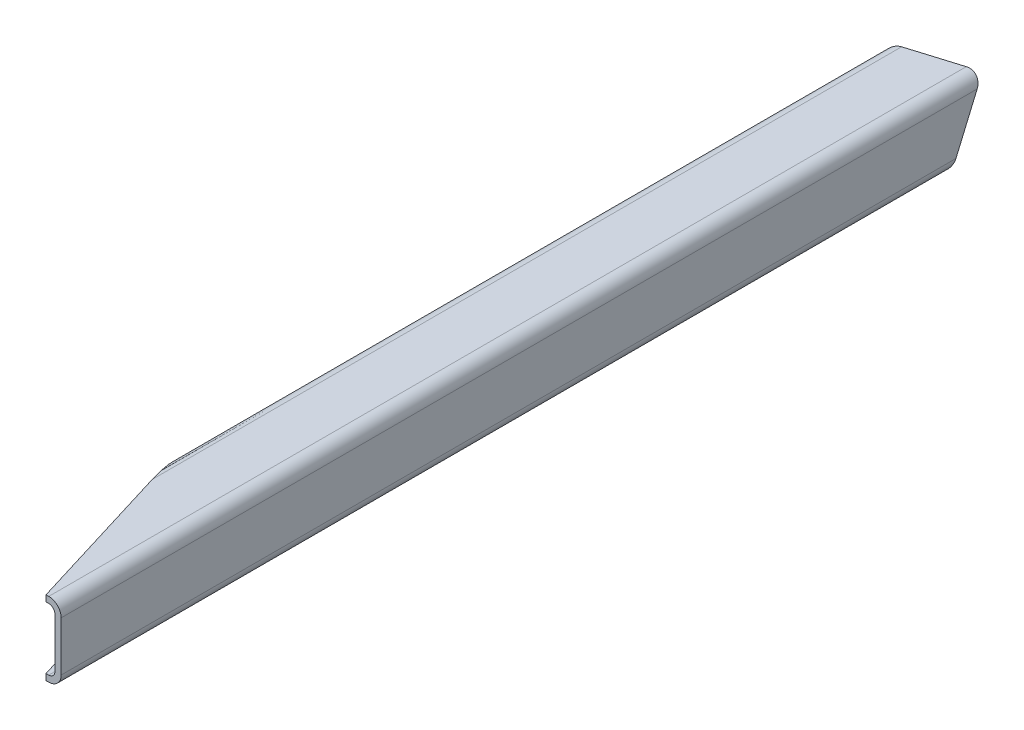
from build123d import *

# Parameters (mm, degrees)
BOSS_EXTRUDE1_DEPTH     = 584.2
CUT_EXTRUDE1_DEPTH      = 1168.4
CUT_EXTRUDE1_DEPTH_BACK = 587.679520693
CUT_EXTRUDE2_DEPTH      = 587.679520693
CUT_EXTRUDE2_DEPTH_BACK = 587.679520693
CUT_EXTRUDE3_DEPTH      = 591.379276398


with BuildPart() as part:
    # Sketch1 → Boss-Extrude1 (new, symmetric)
    with BuildSketch(Plane.XY):
        with BuildLine():
            Line((-25.4, -38.1), (25.4, -38.1))
            ThreePointArc((25.4, -38.1), (34.380256121, -34.380256121), (38.1, -25.4))
            Line((38.1, -25.4), (38.1, 25.4))
            ThreePointArc((38.1, 25.4), (34.380256121, 34.380256121), (25.4, 38.1))
            Line((25.4, 38.1), (-25.4, 38.1))
            ThreePointArc((-25.4, 38.1), (-34.380256121, 34.380256121), (-38.1, 25.4))
            Line((-38.1, 25.4), (-38.1, -25.4))
            ThreePointArc((-38.1, -25.4), (-34.380256121, -34.380256121), (-25.4, -38.1))
        make_face()
        with BuildLine():
            Line((-25.4, 31.75), (25.4, 31.75))
            ThreePointArc((25.4, 31.75), (29.890128061, 29.890128061), (31.75, 25.4))
            Line((31.75, 25.4), (31.75, -25.4))
            ThreePointArc((31.75, -25.4), (29.890128061, -29.890128061), (25.4, -31.75))
            Line((25.4, -31.75), (-25.4, -31.75))
            ThreePointArc((-25.4, -31.75), (-29.890128061, -29.890128061), (-31.75, -25.4))
            Line((-31.75, -25.4), (-31.75, 25.4))
            ThreePointArc((-31.75, 25.4), (-29.890128061, 29.890128061), (-25.4, 31.75))
        make_face(mode=Mode.SUBTRACT)
    extrude(amount=BOSS_EXTRUDE1_DEPTH, both=True)

    # Sketch2 → Cut-Extrude1 (cut, two sides: drawn at the far end of the back side and taken through both)
    with BuildSketch(Plane(origin=(0, 0, 0), x_dir=(1, 0, 0), z_dir=(0, 1, 0)).offset(-CUT_EXTRUDE1_DEPTH_BACK)):
        Polygon((-38.1, -584.2), (38.1, -584.2), (-38.1, -334.961030472), align=None)
    extrude(amount=CUT_EXTRUDE1_DEPTH + CUT_EXTRUDE1_DEPTH_BACK, mode=Mode.SUBTRACT)

    # Sketch3 → Cut-Extrude2 (cut, two sides: drawn at the far end of the back side and taken through both)
    with BuildSketch(Plane(origin=(0, 0, 0), x_dir=(0, 0, -1), z_dir=(1, 0, 0)).offset(-CUT_EXTRUDE2_DEPTH_BACK)):
        Polygon((529.224802616, 234.912944521), (393.7, -38.1), (621.210787101, -151.037335513), (756.735589716, 121.975609008), align=None)
    extrude(amount=CUT_EXTRUDE2_DEPTH + CUT_EXTRUDE2_DEPTH_BACK, mode=Mode.SUBTRACT)

    # Sketch4 → Cut-Extrude3 (cut, through all)
    with BuildSketch(Plane(origin=(0, 38.1, 0), x_dir=(1, 0, 0), z_dir=(0, 1, 0))):
        Polygon((22.568881382, -533.4), (38.1, -533.4), (38.1, -584.2), align=None)
    extrude(amount=-CUT_EXTRUDE3_DEPTH, mode=Mode.SUBTRACT)

    # SurfaceCut1
    split(bisect_by=Plane(origin=(-91.776590451, -128.480237958, -300.187701194), x_dir=(0.9626963442251767, -0.1064681232735412, -0.24875748740910325), z_dir=(0.2705840882525802, 0.37879711890625634, 0.885040673581073)), keep=Keep.TOP)


solid = part.part
